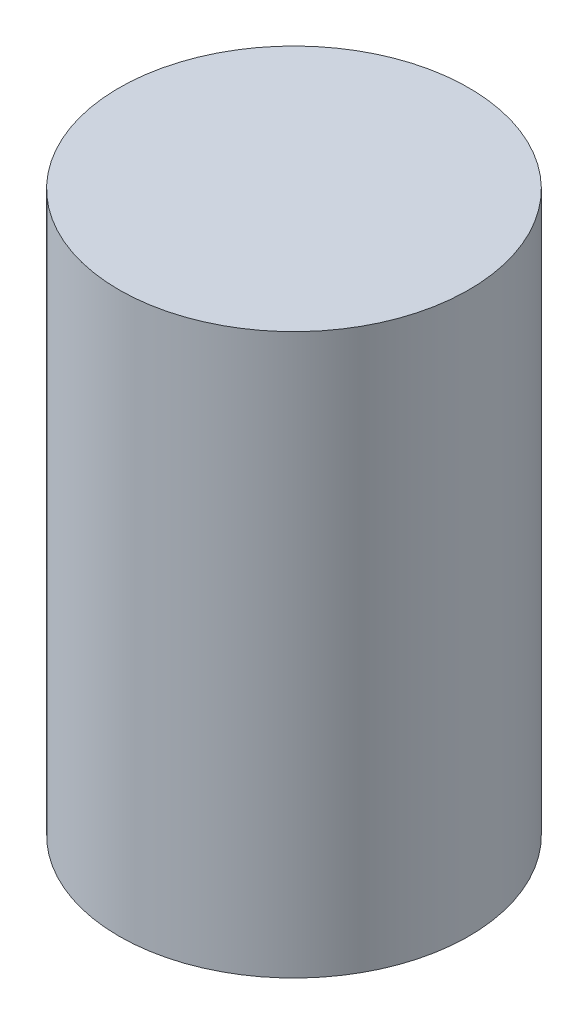
from build123d import *

# Parameters (mm, degrees)
SKETCH1_R           = 37.5
BOSS_EXTRUDE1_DEPTH = 120


with BuildPart() as part:
    # Sketch1 → Boss-Extrude1 (new body)
    with BuildSketch(Plane(origin=(0, 0, 0), x_dir=(1, 0, 0), z_dir=(0, 1, 0))):
        with Locations(Location((0, 0, 0), (0, 0, 270))):
            Circle(SKETCH1_R)
    extrude(amount=BOSS_EXTRUDE1_DEPTH)


solid = part.part
